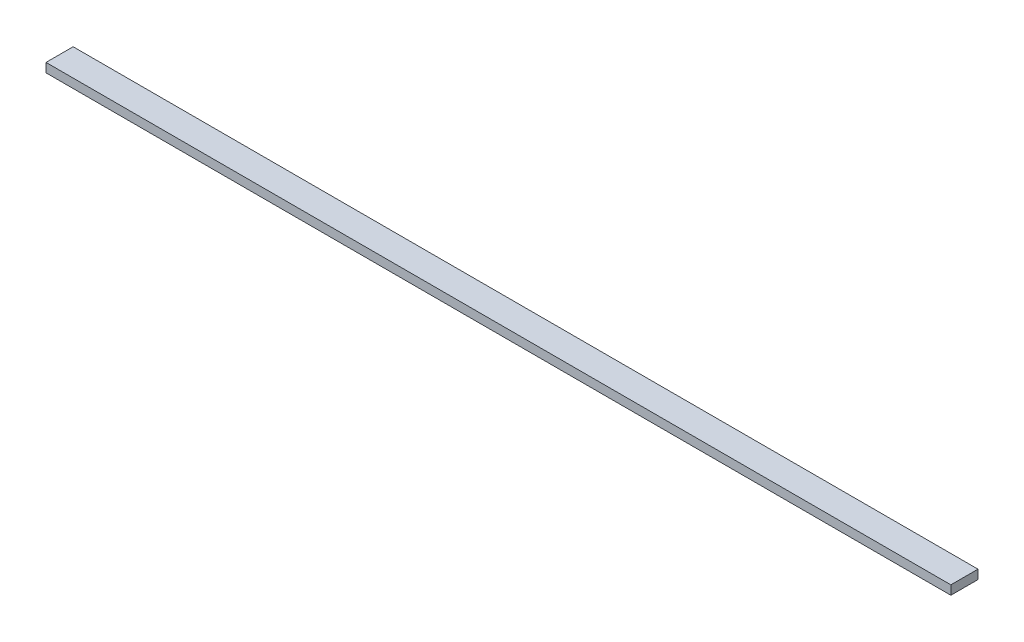
from build123d import *

# Parameters (mm, degrees)
SKETCH1_W           = 600
SKETCH1_H           = 18
BOSS_EXTRUDE1_DEPTH = 6


with BuildPart() as part:
    # Sketch1 → Boss-Extrude1 (new body)
    with BuildSketch(Plane(origin=(0, 0, 0), x_dir=(1, 0, 0), z_dir=(0, 1, 0))):
        with Locations((239.319727891, -9.367346939)):
            Rectangle(SKETCH1_W, SKETCH1_H)
    extrude(amount=BOSS_EXTRUDE1_DEPTH)


solid = part.part
